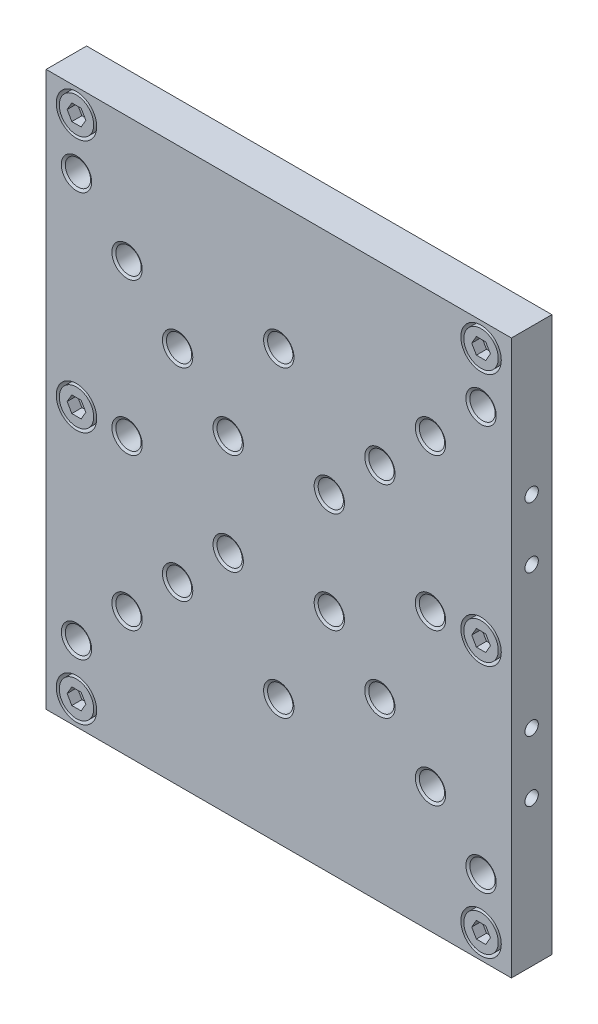
from build123d import *

# Parameters (mm, degrees)
SKETCH1_W                                    = 115
SKETCH1_H                                    = 137
EXTRUDE1_DEPTH                               = 10
CBORE_FOR_M5_SHCS1_D                         = 5.7912
CBORE_FOR_M5_SHCS1_CBORE_D                   = 10
CBORE_FOR_M5_SHCS1_CBORE_DEPTH               = 5.5
TAPPED_HOLE_FOR_M6X1_0_HELICOIL1_D           = 6.25
TAPPED_HOLE_FOR_M6X1_0_HELICOIL1_CSINK_D     = 7.5
TAPPED_HOLE_FOR_M6X1_0_HELICOIL1_CSINK_ANGLE = 120
TAPPED_HOLE_FOR_M6X1_0_HELICOIL2_D           = 6.25
TAPPED_HOLE_FOR_M6X1_0_HELICOIL2_CSINK_D     = 7.5
TAPPED_HOLE_FOR_M6X1_0_HELICOIL2_CSINK_ANGLE = 120
M4X0_7_TAPPED_HOLE1_D                        = 3.3
M4X0_7_TAPPED_HOLE1_DEPTH                    = 10.1
M4X0_7_TAPPED_HOLE1_TIP                      = 0.991420021
M4X0_7_TAPPED_HOLE2_D                        = 3.3
M4X0_7_TAPPED_HOLE2_DEPTH                    = 10.1
M4X0_7_TAPPED_HOLE2_TIP                      = 0.991420021
F_1_4_20_TAPPED_HOLE1_D                      = 5.1562
F_1_4_20_TAPPED_HOLE1_DEPTH                  = 7.62
F_1_4_20_TAPPED_HOLE1_TIP                    = 1.549078762
CUT_EXTRUDE1_DEPTH                           = 1
SKETCH48_R                                   = 4.25
BOSS_EXTRUDE1_DEPTH                          = 5
BOSS_EXTRUDE1_2_DEPTH                        = 5
BOSS_EXTRUDE1_3_DEPTH                        = 5
BOSS_EXTRUDE1_4_DEPTH                        = 5
BOSS_EXTRUDE1_5_DEPTH                        = 5
BOSS_EXTRUDE1_6_DEPTH                        = 5
CUT_EXTRUDE2_DEPTH                           = 2.5


with BuildPart() as part:
    # Sketch1 → Extrude1 (new body)
    with BuildSketch(Plane.XY):
        Rectangle(SKETCH1_W, SKETCH1_H)
    extrude(amount=EXTRUDE1_DEPTH)

    # CBORE for M5 SHCS1 (through all)
    with Locations(Plane.XY.offset(10)):
        with Locations((50, 62.5), (50, 0), (-50, 0), (-50, 62.5), (-50, -62.5), (50, -62.5)):
            CounterBoreHole(CBORE_FOR_M5_SHCS1_D / 2, CBORE_FOR_M5_SHCS1_CBORE_D / 2, CBORE_FOR_M5_SHCS1_CBORE_DEPTH)

    # Tapped Hole for M6x1.0 Helicoil1 (through all)
    with Locations(Plane.XY.offset(10)):
        with Locations((12.5, 12.5), (-12.5, 12.5), (12.5, -12.5), (-12.5, -12.5), (25, 25), (25, -25), (-25, -25), (-25, 25), (37.5, 37.5), (37.5, -37.5), (-37.5, 37.5), (-37.5, -37.5), (37.5, 0), (-37.5, 0), (0, 37.5), (0, -37.5)):
            CounterSinkHole(TAPPED_HOLE_FOR_M6X1_0_HELICOIL1_D / 2, TAPPED_HOLE_FOR_M6X1_0_HELICOIL1_CSINK_D / 2, counter_sink_angle=TAPPED_HOLE_FOR_M6X1_0_HELICOIL1_CSINK_ANGLE)

    # Tapped Hole for M6x1.0 Helicoil2 (through all)
    with Locations(Plane.XY.offset(10)):
        with Locations((-50, 50), (50, 50), (50, -50), (-50, -50)):
            CounterSinkHole(TAPPED_HOLE_FOR_M6X1_0_HELICOIL2_D / 2, TAPPED_HOLE_FOR_M6X1_0_HELICOIL2_CSINK_D / 2, counter_sink_angle=TAPPED_HOLE_FOR_M6X1_0_HELICOIL2_CSINK_ANGLE)

    # M4x0.7 Tapped Hole1
    with Locations(Plane.ZY.offset(57.5)):
        with Locations((5, 17.5), (5, 32.5), (5, -32.5), (5, -17.5)):
            Hole(M4X0_7_TAPPED_HOLE1_D / 2, depth=M4X0_7_TAPPED_HOLE1_DEPTH)
            with Locations((0, 0, -(M4X0_7_TAPPED_HOLE1_DEPTH + M4X0_7_TAPPED_HOLE1_TIP / 2))):  # 118° drill point
                Cone(0, M4X0_7_TAPPED_HOLE1_D / 2, M4X0_7_TAPPED_HOLE1_TIP, mode=Mode.SUBTRACT)

    # M4x0.7 Tapped Hole2
    with Locations(Plane(origin=(57.5, 0, 0), x_dir=(0, 0, -1), z_dir=(1, 0, 0))):
        with Locations((-5, 32.5), (-5, 17.5), (-5, -32.5), (-5, -17.5)):
            Hole(M4X0_7_TAPPED_HOLE2_D / 2, depth=M4X0_7_TAPPED_HOLE2_DEPTH)
            with Locations((0, 0, -(M4X0_7_TAPPED_HOLE2_DEPTH + M4X0_7_TAPPED_HOLE2_TIP / 2))):  # 118° drill point
                Cone(0, M4X0_7_TAPPED_HOLE2_D / 2, M4X0_7_TAPPED_HOLE2_TIP, mode=Mode.SUBTRACT)

    # 1/4-20 Tapped Hole1
    with Locations(Plane(origin=(0, 0, 0), x_dir=(-1, 0, 0), z_dir=(0, 0, -1))):
        with Locations((0, 50)):
            Hole(F_1_4_20_TAPPED_HOLE1_D / 2, depth=F_1_4_20_TAPPED_HOLE1_DEPTH)
            with Locations((0, 0, -(F_1_4_20_TAPPED_HOLE1_DEPTH + F_1_4_20_TAPPED_HOLE1_TIP / 2))):  # 118° drill point
                Cone(0, F_1_4_20_TAPPED_HOLE1_D / 2, F_1_4_20_TAPPED_HOLE1_TIP, mode=Mode.SUBTRACT)

    # Sketch47 → Cut-Extrude1 (cut)
    with BuildSketch(Plane(origin=(0, 0, 0), x_dir=(-1, 0, 0), z_dir=(0, 0, -1))):
        with BuildLine():
            Line((57.5, 38.88), (51, 38.88))
            ThreePointArc((51, 38.88), (48.75493597, 37.95006403), (47.825, 35.705))
            Line((47.825, 35.705), (47.825, 9.795))
            ThreePointArc((47.825, 9.795), (48.75493597, 7.54993597), (51, 6.62))
            Line((51, 6.62), (57.5, 6.62))
            Line((57.5, 6.62), (57.5, 38.88))
        make_face()
        with BuildLine():
            Line((57.5, -16), (46.68, -16))
            ThreePointArc((46.68, -16), (44.431400436, -16.931400436), (43.5, -19.18))
            Line((43.5, -19.18), (43.5, -23.82))
            ThreePointArc((43.5, -23.82), (44.431400436, -26.068599564), (46.68, -27))
            Line((46.68, -27), (57.5, -27))
            Line((57.5, -27), (57.5, -16))
        make_face()
    extrude(amount=-CUT_EXTRUDE1_DEPTH, mode=Mode.SUBTRACT)


with BuildPart() as body_2:
    # Sketch48 → Boss-Extrude1 (new body)
    with BuildSketch(Plane.XY.offset(10)):
        with Locations((50, -62.5)):
            Circle(SKETCH48_R)
    extrude(amount=-BOSS_EXTRUDE1_DEPTH)


with BuildPart() as body_3:
    # Sketch48 → Boss-Extrude1 2 (new body)
    with BuildSketch(Plane.XY.offset(10)):
        with Locations((-50, -62.5)):
            Circle(SKETCH48_R)
    extrude(amount=-BOSS_EXTRUDE1_2_DEPTH)


with BuildPart() as body_4:
    # Sketch48 → Boss-Extrude1 3 (new body)
    with BuildSketch(Plane.XY.offset(10)):
        with Locations((-50, 0)):
            Circle(SKETCH48_R)
    extrude(amount=-BOSS_EXTRUDE1_3_DEPTH)


with BuildPart() as body_5:
    # Sketch48 → Boss-Extrude1 4 (new body)
    with BuildSketch(Plane.XY.offset(10)):
        with Locations((50, 0)):
            Circle(SKETCH48_R)
    extrude(amount=-BOSS_EXTRUDE1_4_DEPTH)


with BuildPart() as body_6:
    # Sketch48 → Boss-Extrude1 5 (new body)
    with BuildSketch(Plane.XY.offset(10)):
        with Locations((50, 62.5)):
            Circle(SKETCH48_R)
    extrude(amount=-BOSS_EXTRUDE1_5_DEPTH)


with BuildPart() as body_7:
    # Sketch48 → Boss-Extrude1 6 (new body)
    with BuildSketch(Plane.XY.offset(10)):
        with Locations((-50, 62.5)):
            Circle(SKETCH48_R)
    extrude(amount=-BOSS_EXTRUDE1_6_DEPTH)


with BuildPart() as cut_extrude2_tool:
    # Sketch49 → Cut-Extrude2 (new body)
    with BuildSketch(Plane.XY.offset(10)):
        Polygon((51.154700538, -64.5), (48.845299462, -64.5), (47.690598923, -62.5), (48.845299462, -60.5), (51.154700538, -60.5), (52.309401077, -62.5), align=None)
        Polygon((-48.845299462, -64.5), (-51.154700538, -64.5), (-52.309401077, -62.5), (-51.154700538, -60.5), (-48.845299462, -60.5), (-47.690598923, -62.5), align=None)
        Polygon((-48.845299462, -2), (-51.154700538, -2), (-52.309401077, 0), (-51.154700538, 2), (-48.845299462, 2), (-47.690598923, 0), align=None)
        Polygon((-48.845299462, 60.5), (-51.154700538, 60.5), (-52.309401077, 62.5), (-51.154700538, 64.5), (-48.845299462, 64.5), (-47.690598923, 62.5), align=None)
        Polygon((51.154700538, -2), (48.845299462, -2), (47.690598923, 0), (48.845299462, 2), (51.154700538, 2), (52.309401077, 0), align=None)
        Polygon((51.154700538, 60.5), (48.845299462, 60.5), (47.690598923, 62.5), (48.845299462, 64.5), (51.154700538, 64.5), (52.309401077, 62.5), align=None)
    extrude(amount=-CUT_EXTRUDE2_DEPTH)


with BuildPart() as body_2_1:
    add(body_2.part)

    # Cut-Extrude2: cut by cut_extrude2_tool
    add(cut_extrude2_tool.part, mode=Mode.SUBTRACT)


with BuildPart() as body_3_1:
    add(body_3.part)

    # Cut-Extrude2: cut by cut_extrude2_tool
    add(cut_extrude2_tool.part, mode=Mode.SUBTRACT)


with BuildPart() as body_4_1:
    add(body_4.part)

    # Cut-Extrude2: cut by cut_extrude2_tool
    add(cut_extrude2_tool.part, mode=Mode.SUBTRACT)


with BuildPart() as body_5_1:
    add(body_5.part)

    # Cut-Extrude2: cut by cut_extrude2_tool
    add(cut_extrude2_tool.part, mode=Mode.SUBTRACT)


with BuildPart() as body_6_1:
    add(body_6.part)

    # Cut-Extrude2: cut by cut_extrude2_tool
    add(cut_extrude2_tool.part, mode=Mode.SUBTRACT)


with BuildPart() as body_7_1:
    add(body_7.part)

    # Cut-Extrude2: cut by cut_extrude2_tool
    add(cut_extrude2_tool.part, mode=Mode.SUBTRACT)


solid = Compound([part.part, body_2_1.part, body_3_1.part, body_4_1.part, body_5_1.part, body_6_1.part, body_7_1.part])
